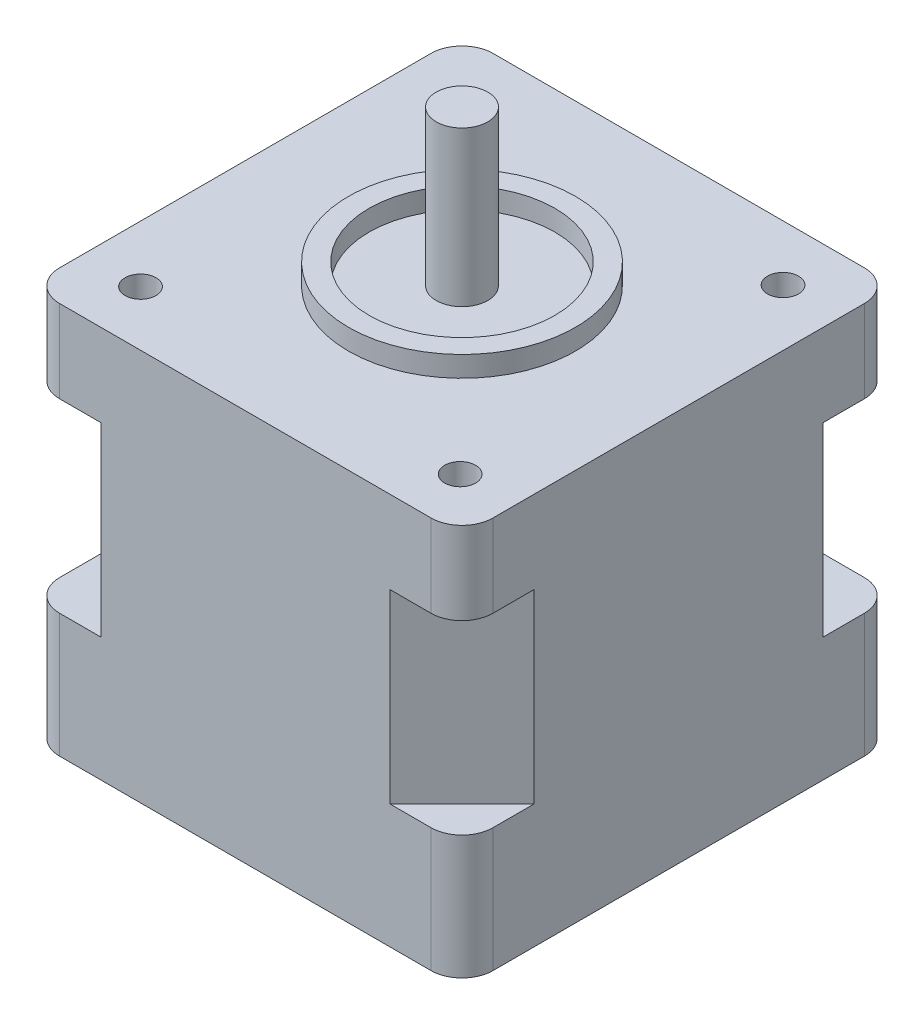
from build123d import *

# Parameters (mm, degrees)
BOSS_EXTRUDE1_DEPTH = 12
BOSS_EXTRUDE2_DEPTH = 18
BOSS_EXTRUDE3_DEPTH = 8
SKETCH5_R           = 11
SKETCH5_R_2         = 9
BOSS_EXTRUDE4_DEPTH = 2
SKETCH6_R           = 2.5
BOSS_EXTRUDE5_DEPTH = 15
SKETCH7_R           = 1.5
CUT_EXTRUDE1_DEPTH  = 4.5
SKETCH9_W           = 15
SKETCH9_H           = 5
BOSS_EXTRUDE6_DEPTH = 5


with BuildPart() as part:
    # Sketch2 → Boss-Extrude1 (new body)
    with BuildSketch(Plane(origin=(0, 0, 0), x_dir=(1, 0, 0), z_dir=(0, 1, 0))):
        with BuildLine():
            Line((-18, 21), (18, 21))
            ThreePointArc((18, 21), (20.121320344, 20.121320344), (21, 18))
            Line((21, 18), (21, -18))
            ThreePointArc((21, -18), (20.121320344, -20.121320344), (18, -21))
            Line((18, -21), (-18, -21))
            ThreePointArc((-18, -21), (-20.121320344, -20.121320344), (-21, -18))
            Line((-21, -18), (-21, 18))
            ThreePointArc((-21, 18), (-20.121320344, 20.121320344), (-18, 21))
        make_face()
    extrude(amount=BOSS_EXTRUDE1_DEPTH)

    # Sketch3 → Boss-Extrude2 (add)
    with BuildSketch(Plane(origin=(0, 12, 0), x_dir=(1, 0, 0), z_dir=(0, 1, 0))):
        Polygon((-21, 14), (-14, 21), (14, 21), (21, 14), (21, -14), (14, -21), (-14, -21), (-21, -14), align=None)
    extrude(amount=BOSS_EXTRUDE2_DEPTH)

    # Sketch4 → Boss-Extrude3 (add)
    with BuildSketch(Plane(origin=(0, 30, 0), x_dir=(1, 0, 0), z_dir=(0, 1, 0))):
        with BuildLine():
            Line((-18, 21), (18, 21))
            ThreePointArc((18, 21), (20.121320344, 20.121320344), (21, 18))
            Line((21, 18), (21, -18))
            ThreePointArc((21, -18), (20.121320344, -20.121320344), (18, -21))
            Line((18, -21), (-18, -21))
            ThreePointArc((-18, -21), (-20.121320344, -20.121320344), (-21, -18))
            Line((-21, -18), (-21, 18))
            ThreePointArc((-21, 18), (-20.121320344, 20.121320344), (-18, 21))
        make_face()
    extrude(amount=BOSS_EXTRUDE3_DEPTH)

    # Sketch5 → Boss-Extrude4 (add)
    with BuildSketch(Plane(origin=(0, 38, 0), x_dir=(1, 0, 0), z_dir=(0, 1, 0))):
        with Locations(Location((0, 0, 0), (0, 0, 270))):
            Circle(SKETCH5_R)
        with Locations(Location((0, 0, 0), (0, 0, 270))):
            Circle(SKETCH5_R_2, mode=Mode.SUBTRACT)
    extrude(amount=BOSS_EXTRUDE4_DEPTH)

    # Sketch6 → Boss-Extrude5 (add)
    with BuildSketch(Plane(origin=(0, 38, 0), x_dir=(1, 0, 0), z_dir=(0, 1, 0))):
        with Locations(Location((0, 0, 0), (0, 0, 270))):
            Circle(SKETCH6_R)
    extrude(amount=BOSS_EXTRUDE5_DEPTH)

    # Sketch7 → Cut-Extrude1 (cut)
    with BuildSketch(Plane(origin=(0, 38, 0), x_dir=(1, 0, 0), z_dir=(0, 1, 0))):
        with Locations(Location((-15.5, 15.5, 0), (0, 0, 270))):
            Circle(SKETCH7_R)
        with Locations(Location((15.505550331, 15.61144176, 0), (0, 0, 270))):
            Circle(SKETCH7_R)
        with Locations(Location((15.732618971, -15.912931541, 0), (0, 0, 270))):
            Circle(SKETCH7_R)
        with Locations(Location((-15.494867745, -15.663236697, 0), (0, 0, 270))):
            Circle(SKETCH7_R)
    extrude(amount=-CUT_EXTRUDE1_DEPTH, mode=Mode.SUBTRACT)

    # Sketch9 → Boss-Extrude6 (add)
    with BuildSketch(Plane(origin=(0, 0, -21), x_dir=(-1, 0, 0), z_dir=(0, 0, -1))):
        with Locations((0, 9.5)):
            Rectangle(SKETCH9_W, SKETCH9_H)
    extrude(amount=BOSS_EXTRUDE6_DEPTH)


solid = part.part
